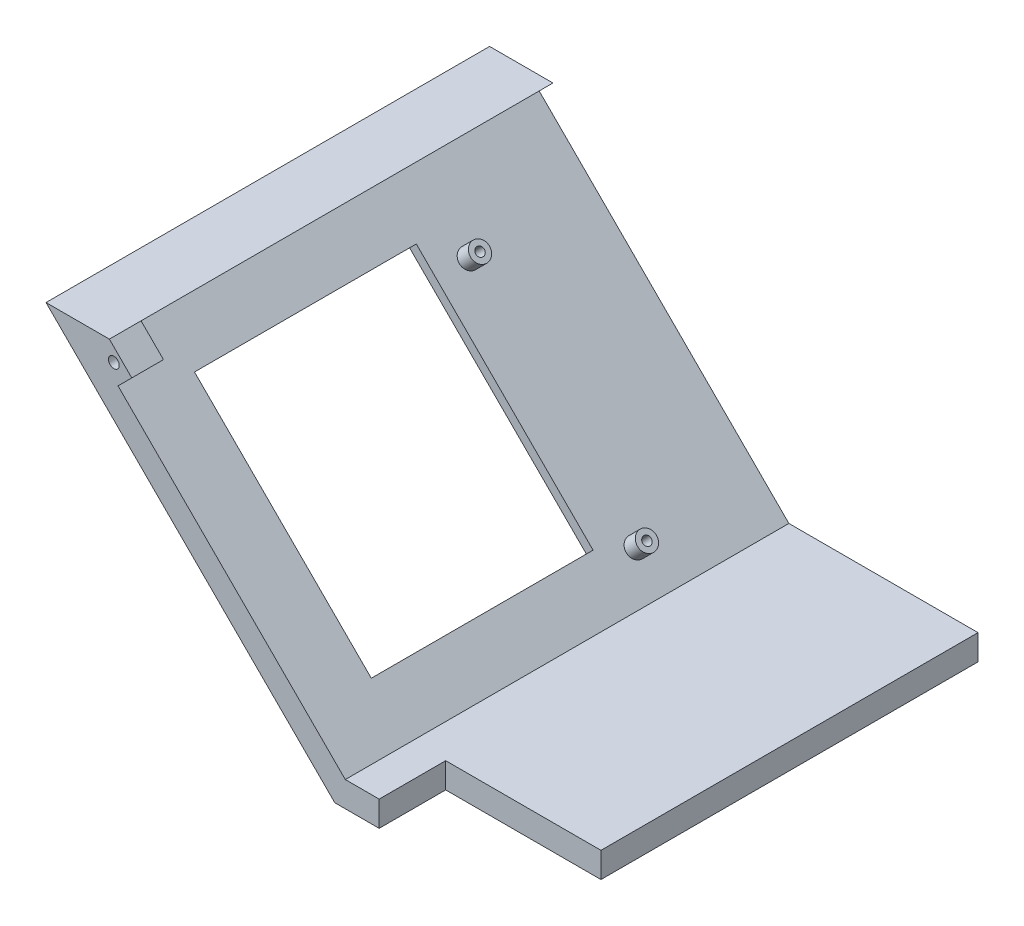
from build123d import *

# Parameters (mm, degrees)
MAIN_EXTRUSION_DEPTH                           = 140
LCD_SKETCH_W                                   = 49
LCD_SKETCH_H                                   = 21
LCD_HOLE_DEPTH                                 = 228.311559319
UP_FIX_EXTRUSION_DEPTH                         = 10
FRAISAGE_POUR_VIS_T_TE_FRAIS_E_M31_D           = 3.4
FRAISAGE_POUR_VIS_T_TE_FRAIS_E_M31_CSINK_D     = 6
FRAISAGE_POUR_VIS_T_TE_FRAIS_E_M31_CSINK_ANGLE = 90
MOTORBOARD_HOLE_SKETCH_W                       = 70
MOTORBOARD_HOLE_SKETCH_H                       = 78.90556621
MOTORBOARD_HOLE_DEPTH                          = 223.903667534
MOTORBOARD_WINDOW_SKETCH_W                     = 86
MOTORBOARD_WINDOW_SKETCH_H                     = 94.90556621
MOTORBOARD_WINDOW_DEPTH                        = 5
MOTORBOARD_FIX_SKETCH_R                        = 3
MOTORBOARD_FIX_EXTRUSION_DEPTH                 = 5
MOTORBOARD_FIX_HOLE_SKETCH_R                   = 1.35
MOTORBOARD_FIX_HOLE_DEPTH                      = 224.282433254


with BuildPart() as part:
    # Main-Sketch → Main-Extrusion (new body)
    with BuildSketch(Plane.XY):
        Polygon((0, 0), (0, 8), (-59.686291501, 8), (-138.493145751, 86.806854249), (-134.15, 91.15), (-154.15, 91.15), (-63, 0), align=None)
    extrude(amount=MAIN_EXTRUSION_DEPTH)

    # Lcd-Sketch → Lcd-Hole (cut, through all)
    with BuildSketch(Plane.XZ):
        with Locations((-24.5, 129.5)):
            Rectangle(LCD_SKETCH_W, LCD_SKETCH_H)
    extrude(amount=-LCD_HOLE_DEPTH, mode=Mode.SUBTRACT)

    # Upp-Fix-Sketch → Up-Fix-Extrusion (add)
    with BuildSketch(Plane.XY.offset(140)):
        Polygon((-134.15, 91.15), (-138.493145751, 86.806854249), (-131.422077939, 79.735786438), (-127.078932188, 84.078932188), align=None)
    extrude(amount=-UP_FIX_EXTRUSION_DEPTH)

    # Fraisage pour vis à tête fraisée M31 (through all)
    with Locations(Plane(origin=(0, 0, 130), x_dir=(-1, 0, 0), z_dir=(0, 0, -1))):
        with Locations((132.735786438, 85.493145751)):
            CounterSinkHole(FRAISAGE_POUR_VIS_T_TE_FRAIS_E_M31_D / 2, FRAISAGE_POUR_VIS_T_TE_FRAIS_E_M31_CSINK_D / 2, counter_sink_angle=FRAISAGE_POUR_VIS_T_TE_FRAIS_E_M31_CSINK_ANGLE)

    # MotorBoard-Hole-Sketch → MotorBoard-Hole (cut, through all)
    with BuildSketch(Plane(origin=(-31.5, -31.5, 0), x_dir=(0, 0, 1), z_dir=(-0.7071067811865486, -0.7071067811865465, 0))):
        with Locations((85, 104.00051032)):
            Rectangle(MOTORBOARD_HOLE_SKETCH_W, MOTORBOARD_HOLE_SKETCH_H)
    extrude(amount=-MOTORBOARD_HOLE_DEPTH, mode=Mode.SUBTRACT)

    # MotorBoard-Window-Sketch → MotorBoard-Window (cut)
    with BuildSketch(Plane(origin=(-31.5, -31.5, 0), x_dir=(0, 0, 1), z_dir=(-0.7071067811865486, -0.7071067811865465, 0))):
        with Locations((85, 104.00051032)):
            Rectangle(MOTORBOARD_WINDOW_SKETCH_W, MOTORBOARD_WINDOW_SKETCH_H)
    extrude(amount=-MOTORBOARD_WINDOW_DEPTH, mode=Mode.SUBTRACT)

    # MotorBoard-Fix-Sketch → MotorBoard-Fix-Extrusion (add)
    with BuildSketch(Plane(origin=(-25.843145751, -25.843145751, 0), x_dir=(0, 0, -1), z_dir=(0.7071067811865486, 0.7071067811865465, 0))):
        with Locations(Location((-39.5, 60.361435714, 0), (0, 0, 270))):
            Circle(MOTORBOARD_FIX_SKETCH_R)
        with Locations(Location((-39.5, 134.861435714, 0), (0, 0, 270))):
            Circle(MOTORBOARD_FIX_SKETCH_R)
    extrude(amount=MOTORBOARD_FIX_EXTRUSION_DEPTH)

    # MotorBoard-Fix-Hole-Sketch → MotorBoard-Fix-Hole (cut, through all)
    with BuildSketch(Plane(origin=(-22.307611845, -22.307611845, 0), x_dir=(0, 0, -1), z_dir=(0.7071067811865487, 0.7071067811865465, 0))):
        with Locations(Location((-39.5, 60.361435714, 0), (0, 0, 90))):
            Circle(MOTORBOARD_FIX_HOLE_SKETCH_R)
        with Locations(Location((-39.5, 134.861435714, 0), (0, 0, 90))):
            Circle(MOTORBOARD_FIX_HOLE_SKETCH_R)
    extrude(amount=-MOTORBOARD_FIX_HOLE_DEPTH, mode=Mode.SUBTRACT)


solid = part.part
